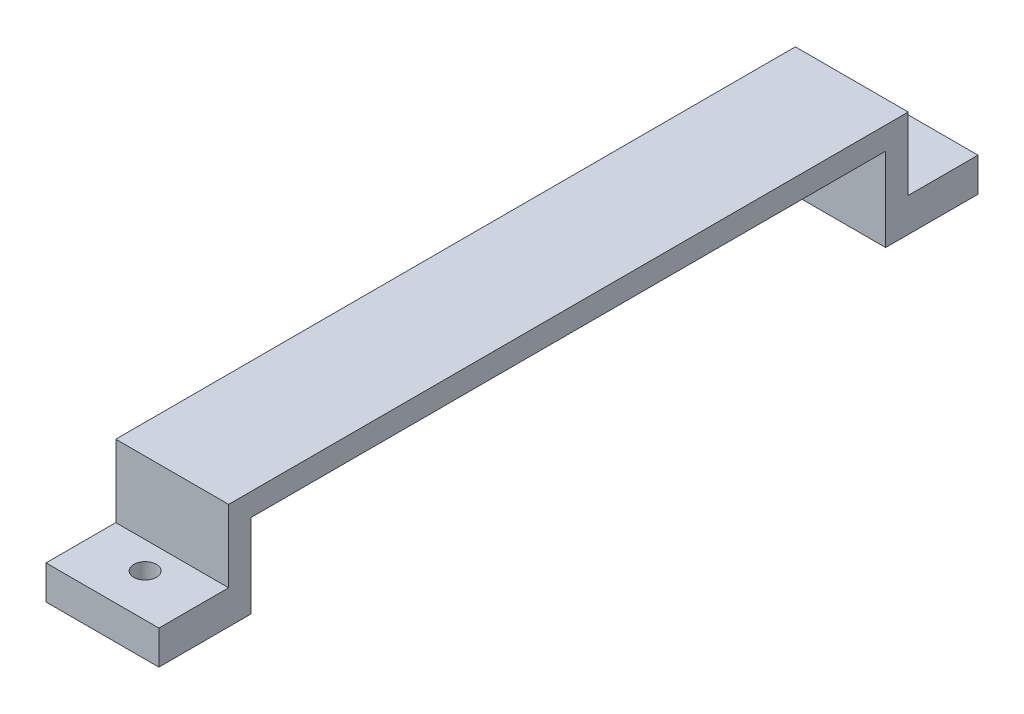
from build123d import *

# Parameters (mm, degrees)
SKETCH_1_W      = 5
SKETCH_1_H      = 4.09
SKETCH_1_R      = 0.5
EXTRUDE_1_DEPTH = 1.5
SKETCH_1_3_W    = 5
SKETCH_1_3_H    = 1
EXTRUDE_2_DEPTH = 3.7
SKETCH_2_W      = 5
SKETCH_2_H      = 15.05
EXTRUDE_3_DEPTH = 1


with BuildPart() as part:
    # Эскиз1 → Бобышка-Вытянуть1 (new body)
    with BuildSketch(Plane(origin=(0, 0, 0), x_dir=(1, 0, 0), z_dir=(0, 1, 0))):
        with Locations((2.5, -2.045)):
            Rectangle(SKETCH_1_W, SKETCH_1_H)
        with Locations((2.5, -1.89)):
            Circle(SKETCH_1_R, mode=Mode.SUBTRACT)
    extrude_1 = extrude(amount=EXTRUDE_1_DEPTH)

    # Эскиз1<3> → Бобышка-Вытянуть2 (add)
    with BuildSketch(Plane(origin=(0, 0, 0), x_dir=(1, 0, 0), z_dir=(0, 1, 0))):
        with Locations((2.5, -3.59)):
            Rectangle(SKETCH_1_3_W, SKETCH_1_3_H)
    extrude_2 = extrude(amount=EXTRUDE_2_DEPTH)

    # Эскиз2 → Бобышка-Вытянуть3 (add)
    with BuildSketch(Plane(origin=(0, 3.7, 0), x_dir=(1, 0, 0), z_dir=(0, 1, 0))):
        with Locations((2.5, -10.615)):
            Rectangle(SKETCH_2_W, SKETCH_2_H)
    extrude_3 = extrude(amount=EXTRUDE_3_DEPTH)

    # Зеркальное отражение1: Бобышка-Вытянуть1, Бобышка-Вытянуть2, Бобышка-Вытянуть3 across plane
    add(extrude_1.mirror(Plane(origin=(0, 4.7, 18.14), x_dir=(1, 0, 0), z_dir=(0, 0, -1))))
    add(extrude_2.mirror(Plane(origin=(0, 4.7, 18.14), x_dir=(1, 0, 0), z_dir=(0, 0, -1))))
    add(extrude_3.mirror(Plane(origin=(0, 4.7, 18.14), x_dir=(1, 0, 0), z_dir=(0, 0, -1))))


solid = part.part
